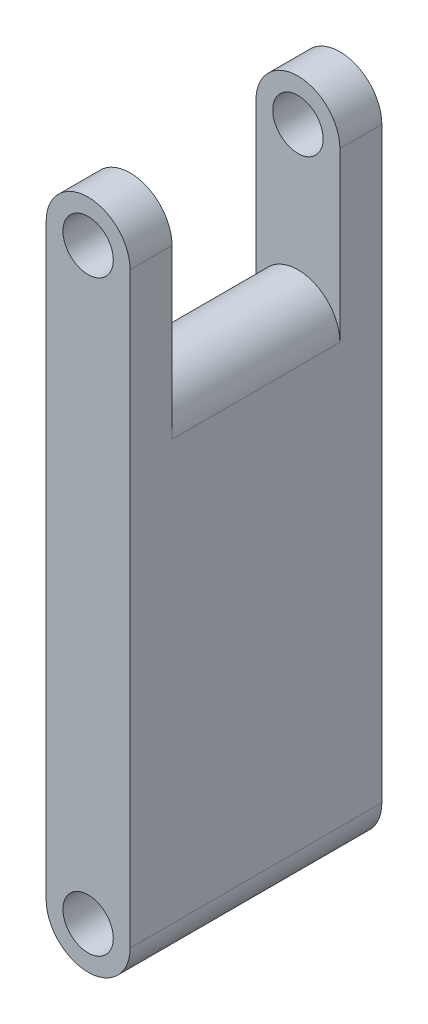
from build123d import *

# Parameters (mm, degrees)
SKETCH1_W           = 12.7
SKETCH1_H           = 101.6
BOSS_EXTRUDE1_DEPTH = 19.05
FILLET2_RADIUS      = 6.35
FILLET2_LENGTH      = 38.1
SKETCH2_R           = 3.81
CUT_EXTRUDE1_DEPTH  = 38.1
FILLET3_RADIUS      = 6.35
FILLET3_LENGTH      = 38.1
SKETCH3_W           = 25.4
SKETCH3_H           = 25.4
CUT_EXTRUDE2_DEPTH  = 56.72102386
FILLET4_RADIUS      = 6.35
FILLET4_LENGTH      = 25.4


with BuildPart() as part:
    # Sketch1 → Boss-Extrude1 (new, symmetric)
    with BuildSketch(Plane.XY):
        Rectangle(SKETCH1_W, SKETCH1_H)
    extrude(amount=BOSS_EXTRUDE1_DEPTH, both=True)

    # Fillet2: full round fillet: the end face becomes a half cylinder, R = half its width
    fillet2_face = Plane((0, -50.8, 0), x_dir=(0, 0, 1), z_dir=(0, -1, 0))  # on the end face: x along it, z out of the body
    fillet2_slab = fillet2_face.offset(-FILLET2_RADIUS / 2) * Box(FILLET2_LENGTH, 2 * FILLET2_RADIUS, FILLET2_RADIUS, mode=Mode.PRIVATE)  # the body's end, R deep
    fillet2_round = Plane((0, -44.45, 0), x_dir=(0, -1, 0), z_dir=(0, 0, 1)) * Cylinder(FILLET2_RADIUS, FILLET2_LENGTH, mode=Mode.PRIVATE)  # its axis R under the face
    add(fillet2_slab - fillet2_round, mode=Mode.SUBTRACT)

    # Sketch2 → Cut-Extrude1 (cut)
    with BuildSketch(Plane.XY.offset(19.05)):
        with Locations((0, -44.45)):
            Circle(SKETCH2_R)
    cut_extrude1 = extrude(amount=-CUT_EXTRUDE1_DEPTH, mode=Mode.SUBTRACT)

    # Mirror3: Cut-Extrude1 across plane
    add(cut_extrude1.mirror(Plane.ZX), mode=Mode.SUBTRACT)

    # Fillet3: full round fillet: the end face becomes a half cylinder, R = half its width
    fillet3_face = Plane((0, 50.8, 0), x_dir=(0, 0, 1), z_dir=(0, 1, 0))  # on the end face: x along it, z out of the body
    fillet3_slab = fillet3_face.offset(-FILLET3_RADIUS / 2) * Box(FILLET3_LENGTH, 2 * FILLET3_RADIUS, FILLET3_RADIUS, mode=Mode.PRIVATE)  # the body's end, R deep
    fillet3_round = Plane((0, 44.45, 0), x_dir=(0, 1, 0), z_dir=(0, 0, 1)) * Cylinder(FILLET3_RADIUS, FILLET3_LENGTH, mode=Mode.PRIVATE)  # its axis R under the face
    add(fillet3_slab - fillet3_round, mode=Mode.SUBTRACT)

    # Sketch3 → Cut-Extrude2 (cut, through all)
    with BuildSketch(Plane.ZY.offset(6.35)):
        with Locations((0, 38.1)):
            Rectangle(SKETCH3_W, SKETCH3_H)
    extrude(amount=-CUT_EXTRUDE2_DEPTH, mode=Mode.SUBTRACT)

    # Fillet4: full round fillet: the end face becomes a half cylinder, R = half its width
    fillet4_face = Plane((0, 25.4, 0), x_dir=(0, 0, -1), z_dir=(0, 1, 0))  # on the end face: x along it, z out of the body
    fillet4_slab = fillet4_face.offset(-FILLET4_RADIUS / 2) * Box(FILLET4_LENGTH, 2 * FILLET4_RADIUS, FILLET4_RADIUS, mode=Mode.PRIVATE)  # the body's end, R deep
    fillet4_round = Plane((0, 19.05, 0), x_dir=(0, 1, 0), z_dir=(0, 0, -1)) * Cylinder(FILLET4_RADIUS, FILLET4_LENGTH, mode=Mode.PRIVATE)  # its axis R under the face
    add(fillet4_slab - fillet4_round, mode=Mode.SUBTRACT)


solid = part.part
